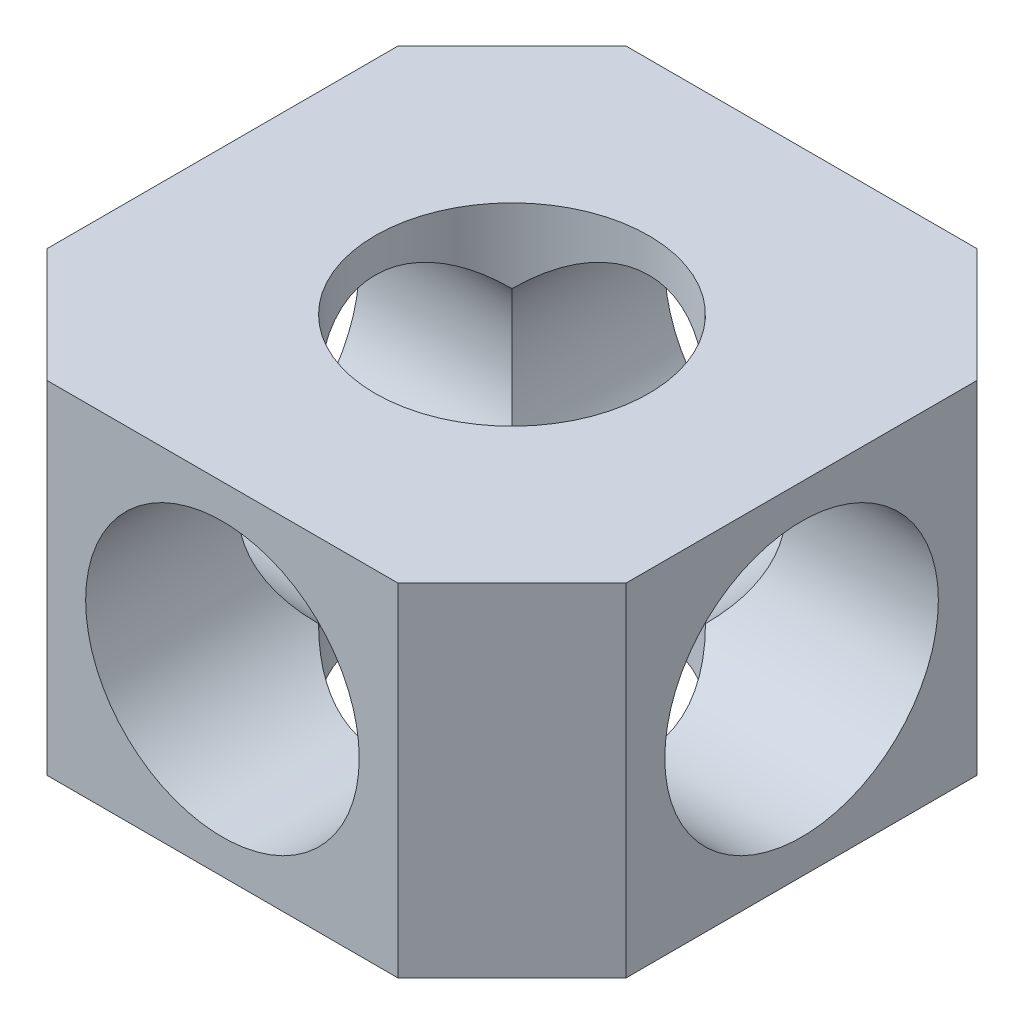
from build123d import *

# Parameters (mm, degrees)
SKETCH_1_W               = 25.4
SKETCH_1_H               = 25.4
EXTRUDE_1_DEPTH          = 15
CUT_EXTRUDE_1_DEPTH      = 15
SKETCH_3_R               = 6
CUT_EXTRUDE_2_DEPTH      = 15
CUT_EXTRUDE_3_DEPTH      = 15
CUT_EXTRUDE_3_DEPTH_BACK = 15
SKETCH_4_R               = 6
CUT_EXTRUDE_4_DEPTH      = 15
CUT_EXTRUDE_4_DEPTH_BACK = 15
SKETCH_5_R               = 6


with BuildPart() as part:
    # 草图1 → 凸台-拉伸1 (new body)
    with BuildSketch(Plane(origin=(0, 0, 0), x_dir=(1, 0, 0), z_dir=(0, 1, 0))):
        Rectangle(SKETCH_1_W, SKETCH_1_H)
    extrude(amount=EXTRUDE_1_DEPTH)

    # 草图2 → 切除-拉伸1 (cut)
    with BuildSketch(Plane(origin=(0, 0, 0), x_dir=(1, 0, 0), z_dir=(0, 1, 0))):
        Polygon((-12.7, 12.7), (-12.7, 7.7), (-7.7, 12.7), align=None)
        Polygon((12.7, 12.7), (12.7, 7.7), (7.7, 12.7), align=None)
        Polygon((12.7, -12.7), (12.7, -7.7), (7.7, -12.7), align=None)
        Polygon((-12.7, -12.7), (-12.7, -7.7), (-7.7, -12.7), align=None)
    extrude(amount=CUT_EXTRUDE_1_DEPTH, mode=Mode.SUBTRACT)

    # 草图3 → 切除-拉伸2 (cut)
    with BuildSketch(Plane(origin=(0, 0, 0), x_dir=(1, 0, 0), z_dir=(0, 1, 0))):
        with Locations(Location((0, 0, 0), (0, 0, 270))):
            Circle(SKETCH_3_R)
    extrude(amount=CUT_EXTRUDE_2_DEPTH, mode=Mode.SUBTRACT)

    # 草图4 → 切除-拉伸3 (cut, two sides: drawn at the far end of the back side and taken through both)
    with BuildSketch(Plane.XY.offset(-CUT_EXTRUDE_3_DEPTH_BACK)):
        with Locations((0, 7.5)):
            Circle(SKETCH_4_R)
    extrude(amount=CUT_EXTRUDE_3_DEPTH + CUT_EXTRUDE_3_DEPTH_BACK, mode=Mode.SUBTRACT)

    # 草图5 → 切除-拉伸4 (cut, two sides: drawn at the far end of the back side and taken through both)
    with BuildSketch(Plane(origin=(0, 0, 0), x_dir=(0, 0, -1), z_dir=(1, 0, 0)).offset(-CUT_EXTRUDE_4_DEPTH_BACK)):
        with Locations(Location((0, 7.5, 0), (0, 0, 180))):
            Circle(SKETCH_5_R)
    extrude(amount=CUT_EXTRUDE_4_DEPTH + CUT_EXTRUDE_4_DEPTH_BACK, mode=Mode.SUBTRACT)


solid = part.part
